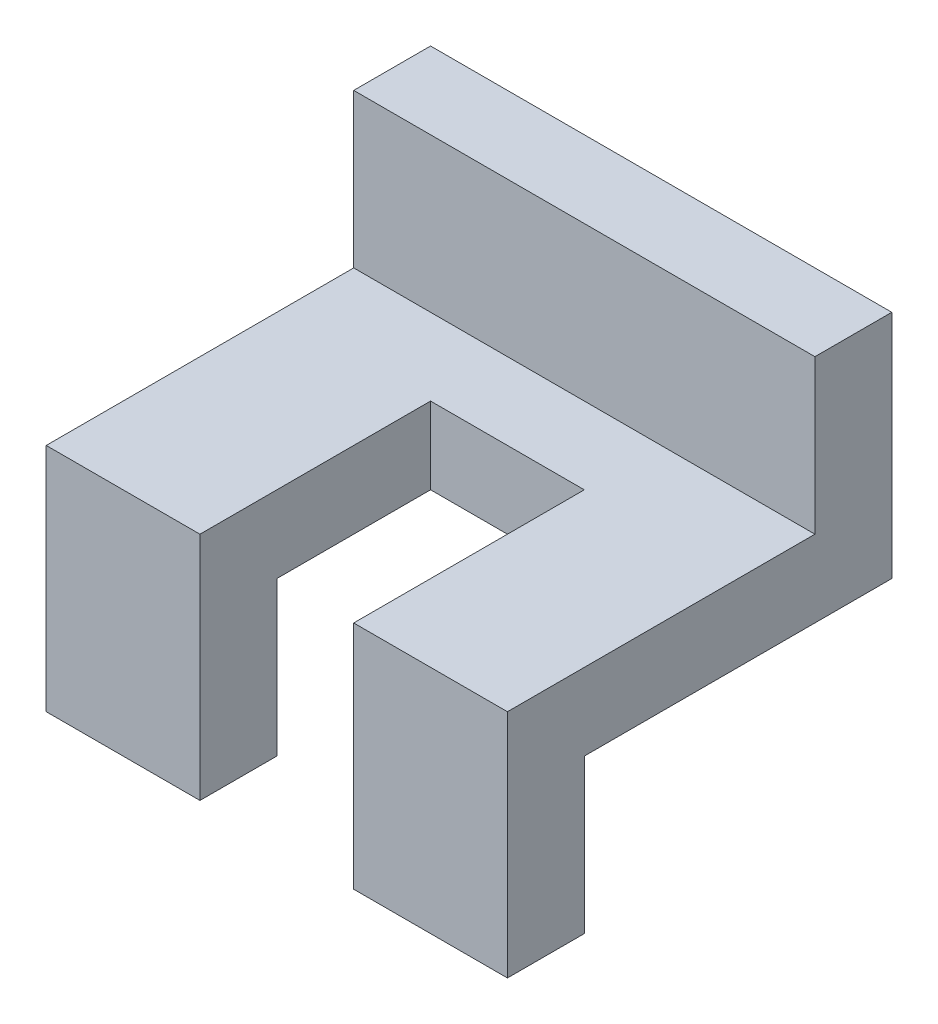
from build123d import *

# Parameters (mm, degrees)
BOSS_EXTRUDE1_DEPTH     = 19.05
CUT_EXTRUDE1_DEPTH      = 38.1
CUT_EXTRUDE1_DEPTH_BACK = 42.639734629
SKETCH2_W               = 12.7
SKETCH2_H               = 19.05


with BuildPart() as part:
    # Sketch1 → Boss-Extrude1 (new, symmetric)
    with BuildSketch(Plane(origin=(0, 0, 0), x_dir=(0, 0, -1), z_dir=(1, 0, 0))):
        Polygon((0, 0), (0, 19.05), (25.4, 19.05), (25.4, 31.75), (31.75, 31.75), (31.75, 12.7), (6.35, 12.7), (6.35, 0), align=None)
    extrude(amount=BOSS_EXTRUDE1_DEPTH, both=True)

    # Sketch2 → Cut-Extrude1 (cut, two sides: drawn at the far end of the back side and taken through both)
    with BuildSketch(Plane(origin=(0, 19.05, 0), x_dir=(1, 0, 0), z_dir=(0, 1, 0)).offset(-CUT_EXTRUDE1_DEPTH_BACK)):
        with Locations((0, 9.525)):
            Rectangle(SKETCH2_W, SKETCH2_H)
    extrude(amount=CUT_EXTRUDE1_DEPTH + CUT_EXTRUDE1_DEPTH_BACK, mode=Mode.SUBTRACT)


solid = part.part
